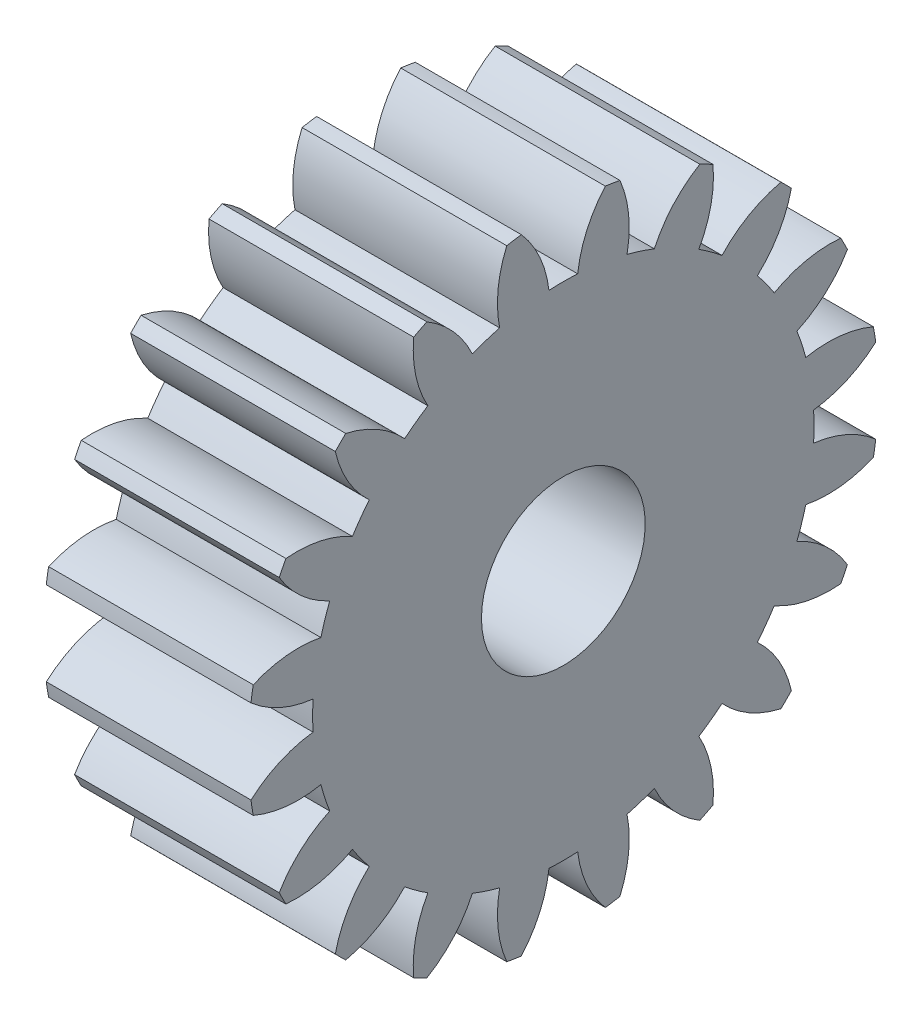
from build123d import *

# Parameters (mm, degrees)
BASPROSKE_W     = 5
BASPROSKE_H     = 7.7
TOOTHCUT_DEPTH  = 12.982487221
TEETHCUTS_COUNT = 20
TEETHCUTS_ANGLE = 342
BORSKE_R        = 2
BORE_DEPTH      = 50.0000508


with BuildPart() as part:
    # BasProSke → Base-Revolve (revolve)
    with BuildSketch(Plane(origin=(0, 0, 0), x_dir=(1, 0, 0), z_dir=(0, 1, 0)), mode=Mode.PRIVATE) as base_revolve_sk:
        with Locations((2.5, 3.85)):
            Rectangle(BASPROSKE_W, BASPROSKE_H)
    revolve(base_revolve_sk.sketch.rotate(Axis((-10, 0, 0), (1, 0, 0)), 180), axis=Axis((-10, 0, 0), (1, 0, 0)))

    # TooCutSke → ToothCut (cut, through all)
    with BuildSketch(Plane(origin=(0, 0, 0), x_dir=(0, 0, -1), z_dir=(1, 0, 0))):
        with BuildLine():
            ThreePointArc((0.350524468, 6.11396014), (0, 6.124), (-0.350524468, 6.11396014))
            ThreePointArc((-0.350524468, 6.11396014), (-0.579534642, 6.937844235), (-1.04652851, 7.654187301))
            ThreePointArc((-1.04652851, 7.654187301), (0, 7.7254), (1.04652851, 7.654187301))
            ThreePointArc((1.04652851, 7.654187301), (0.579534642, 6.937844235), (0.350524468, 6.11396014))
        make_face()
    toothcut = extrude(amount=TOOTHCUT_DEPTH, mode=Mode.SUBTRACT)

    # TeethCuts: ToothCut ×20 about axis
    teethcuts_axis = Axis((-10, 0, 0), (1, 0, 0))
    for i in range(1, TEETHCUTS_COUNT):
        add(toothcut.rotate(teethcuts_axis, i * TEETHCUTS_ANGLE / (TEETHCUTS_COUNT - 1)), mode=Mode.SUBTRACT)

    # BorSke → Bore (cut, symmetric)
    with BuildSketch(Plane(origin=(0, 0, 0), x_dir=(0, 0, -1), z_dir=(1, 0, 0))):
        with Locations(Location((0, 0, 0), (0, 0, 180))):
            Circle(BORSKE_R)
    extrude(amount=BORE_DEPTH, both=True, mode=Mode.SUBTRACT)


solid = part.part
